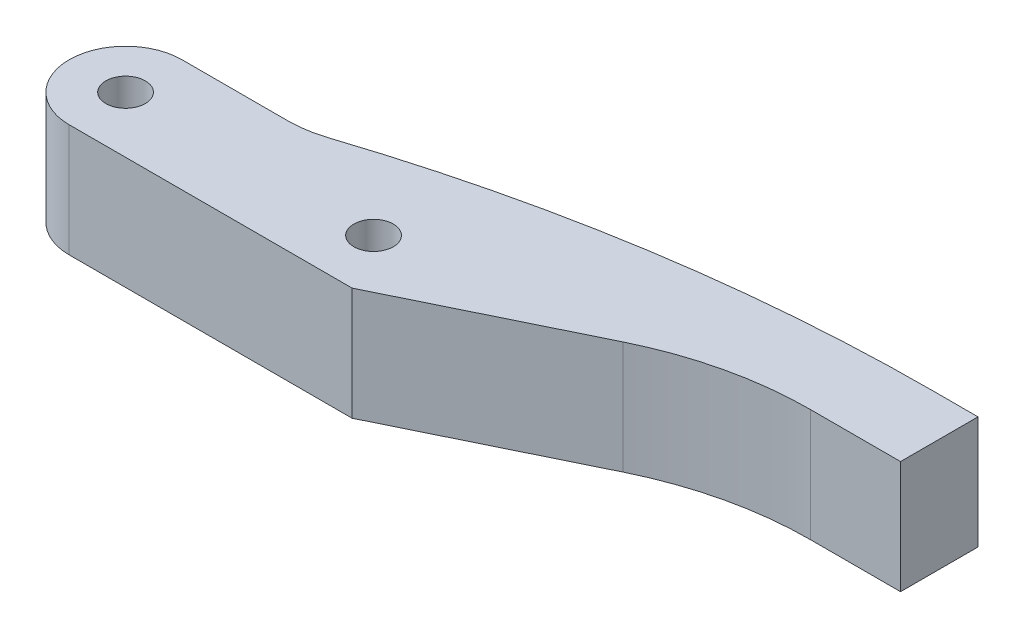
from build123d import *

# Parameters (mm, degrees)
SKETCH_1_R      = 5
SKETCH_1_R_2    = 1.75
EXTRUDE_1_DEPTH = 10
EXTRUDE_START   = -10
EXTRUDE_2_DEPTH = 10
FILLET_1_R      = 10


with BuildPart() as part:
    # 草图1 → 凸台-拉伸1 (new body)
    # profile 1 of 3: a face of its own
    with BuildSketch(Plane(origin=(0, 0, 0), x_dir=(1, 0, 0), z_dir=(0, 1, 0))):
        Circle(SKETCH_1_R)
        with Locations(Location((0, 0, 0), (0, 0, 270))):
            Circle(SKETCH_1_R_2, mode=Mode.SUBTRACT)
    # profile 2 of 3: a face of its own
    with BuildSketch(Plane(origin=(0, 0, 0), x_dir=(1, 0, 0), z_dir=(0, 1, 0))):
        with BuildLine():
            Line((22, 5), (0, 5))
            ThreePointArc((0, 5), (3.535533906, 3.535533906), (5, 0))
            ThreePointArc((5, 0), (3.535533906, -3.535533906), (0, -5))
            Line((0, -5), (22, -5))
            ThreePointArc((22, -5), (17, 0), (22, 5))
        make_face()
    # profile 3 of 3: a face of its own
    with BuildSketch(Plane(origin=(0, 0, 0), x_dir=(1, 0, 0), z_dir=(0, 1, 0))):
        with Locations((22, 0)):
            Circle(SKETCH_1_R)
        with Locations(Location((22, 0, 0), (0, 0, 270))):
            Circle(SKETCH_1_R_2, mode=Mode.SUBTRACT)
    extrude(amount=EXTRUDE_1_DEPTH)

    # 草图2 → 凸台-拉伸2 (add)
    with BuildSketch(Plane(origin=(0, 10, 0), x_dir=(1, 0, 0), z_dir=(0, 1, 0)).offset(EXTRUDE_START)):
        with BuildLine():
            Line((22, -5), (25.0919928, -5))
            Line((25.0919928, -5), (41.259704507, 2.885519882))
            ThreePointArc((41.259704507, 2.885519882), (47.82742716, 5.211272452), (54.75, 6))
            Line((54.75, 6), (62.75, 6))
            Line((62.75, 6), (62.75, 12.87))
            Line((62.75, 12.87), (58.75, 12.87))
            ThreePointArc((58.75, 12.87), (34.552895834, 10.889316888), (11, 5))
            Line((11, 5), (22, 5))
            ThreePointArc((22, 5), (27, 0), (22, -5))
        make_face()
    extrude(amount=EXTRUDE_2_DEPTH)

    # 圆角1
    fillet_1_edges = [part.edges().sort_by_distance(p)[0] for p in [
        (11, 5, -5),
    ]]
    fillet(fillet_1_edges, radius=FILLET_1_R)


solid = part.part
